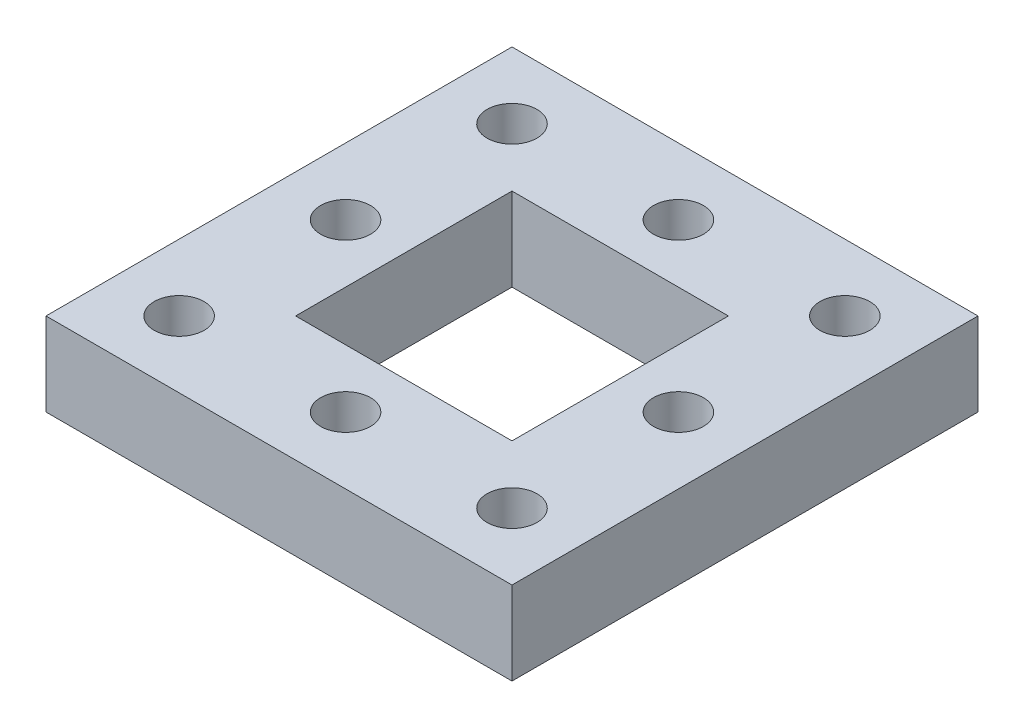
from build123d import *

# Parameters (mm, degrees)
SKETCH_1_W          = 28
SKETCH_1_H          = 28
SKETCH_1_W_2        = 13
SKETCH_1_H_2        = 13
EXTRUDE_1_DEPTH     = 5
SKETCH_3_R          = 1.5
CUT_EXTRUDE_1_DEPTH = 40.912404087
SKETCH_6_R          = 1.5
CUT_EXTRUDE_2_DEPTH = 40.912404087


with BuildPart() as part:
    # Эскиз1 → Бобышка-Вытянуть1 (new body)
    with BuildSketch(Plane(origin=(0, 0, 0), x_dir=(1, 0, 0), z_dir=(0, 1, 0))):
        with Locations((14, 14)):
            Rectangle(SKETCH_1_W, SKETCH_1_H)
        with Locations((14, 14)):
            Rectangle(SKETCH_1_W_2, SKETCH_1_H_2, mode=Mode.SUBTRACT)
    extrude(amount=EXTRUDE_1_DEPTH)

    # Эскиз3 → Вырез-Вытянуть1 (cut, through all)
    with BuildSketch(Plane(origin=(0, 5, 0), x_dir=(1, 0, 0), z_dir=(0, 1, 0))):
        with Locations(Location((24, 24, 0), (0, 0, 270))):
            Circle(SKETCH_3_R)
    extrude(amount=-CUT_EXTRUDE_1_DEPTH, mode=Mode.SUBTRACT)

    # Эскиз6 → Вырез-Вытянуть2 (cut, through all)
    with BuildSketch(Plane(origin=(0, 5, 0), x_dir=(1, 0, 0), z_dir=(0, 1, 0))):
        with Locations(Location((4, 24, 0), (0, 0, 270))):
            Circle(SKETCH_6_R)
        with Locations(Location((4, 4, 0), (0, 0, 270))):
            Circle(SKETCH_6_R)
        with Locations(Location((24, 4, 0), (0, 0, 270))):
            Circle(SKETCH_6_R)
        with Locations(Location((24, 14, 0), (0, 0, 270))):
            Circle(SKETCH_6_R)
        with Locations(Location((14, 24, 0), (0, 0, 270))):
            Circle(SKETCH_6_R)
        with Locations(Location((4, 14, 0), (0, 0, 270))):
            Circle(SKETCH_6_R)
        with Locations(Location((14, 4, 0), (0, 0, 270))):
            Circle(SKETCH_6_R)
    extrude(amount=-CUT_EXTRUDE_2_DEPTH, mode=Mode.SUBTRACT)


solid = part.part
